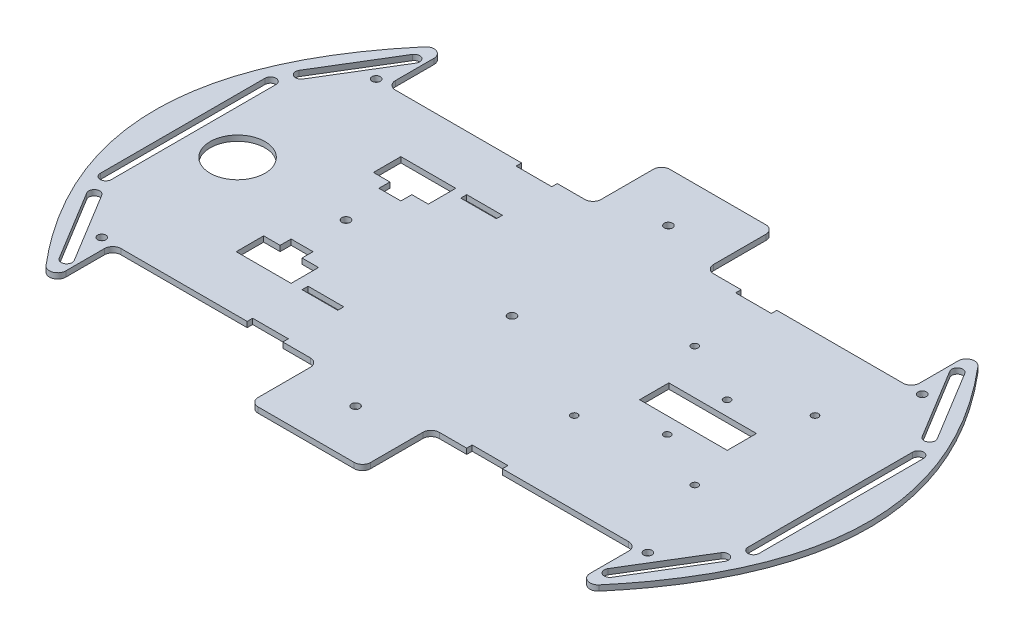
from build123d import *

# Parameters (mm, degrees)
SKETCH1_R           = 1.5
SKETCH1_W           = 13
SKETCH1_H           = 2.19615452
SKETCH1_R_2         = 1.25
SKETCH1_R_3         = 10
SKETCH1_W_2         = 31.947413913
SKETCH1_H_2         = 10.649137971
BOSS_EXTRUDE1_DEPTH = 2
FILLET1_R           = 3


with BuildPart() as part:
    # Sketch1 → Boss-Extrude1 (new body)
    with BuildSketch(Plane(origin=(0, 0, 0), x_dir=(1, 0, 0), z_dir=(0, 1, 0))):
        with BuildLine():
            Line((-95.5, 69), (-95.5, 75))
            add(Edge.make_bspline(
                [(-95.5, 75), (-129.99999983, 37.500000185), (-130, 3.7e-07)],
                knots=[0, 0, 0, 0.499999998, 0.499999998, 0.499999998], degree=2))
            add(Edge.make_bspline(
                [(-130, 3.7e-07), (-130.00000017, -37.499999815), (-95.5, -75)],
                knots=[0.499999998, 0.499999998, 0.499999998, 1, 1, 1], degree=2))
            Line((-95.5, -75), (-95.5, -50))
            Line((-95.5, -50), (-46.5, -50))
            Line((-46.5, -50), (-46.5, -48))
            Line((-46.5, -48), (-33.5, -48))
            Line((-33.5, -48), (-33.5, -50))
            Line((-33.5, -50), (-20.5, -50))
            Line((-20.5, -50), (-20.5, -75))
            Line((-20.5, -75), (20.5, -75))
            Line((20.5, -75), (20.5, -50))
            Line((20.5, -50), (33.5, -50))
            Line((33.5, -50), (33.5, -48))
            Line((33.5, -48), (46.5, -48))
            Line((46.5, -48), (46.5, -50))
            Line((46.5, -50), (95.5, -50))
            Line((95.5, -50), (95.5, -75))
            add(Edge.make_bspline(
                [(130, -5.22e-07), (129.99999976, -37.500000261), (95.5, -75)],
                knots=[0.500000003, 0.500000003, 0.500000003, 1, 1, 1], degree=2))
            add(Edge.make_bspline(
                [(95.5, 75), (130.00000024, 37.499999739), (130, -5.22e-07)],
                knots=[0, 0, 0, 0.500000003, 0.500000003, 0.500000003], degree=2))
            Line((95.5, 75), (95.5, 50))
            Line((95.5, 50), (46.5, 50))
            Line((46.5, 50), (46.5, 48))
            Line((46.5, 48), (33.5, 48))
            Line((33.5, 48), (33.5, 50))
            Line((33.5, 50), (20.5, 50))
            Line((20.5, 50), (20.5, 75))
            Line((20.5, 75), (0, 75))
            Line((0, 75), (-20.5, 75))
            Line((-20.5, 75), (-20.5, 50))
            Line((-20.5, 50), (-33.5, 50))
            Line((-33.5, 50), (-33.5, 48))
            Line((-33.5, 48), (-46.5, 48))
            Line((-46.5, 48), (-46.5, 50))
            Line((-46.5, 50), (-95.5, 50))
            Line((-95.5, 50), (-95.5, 69))
        make_face()
        with BuildLine():
            Line((-100.665133807, -64.355482792), (-116.252551949, -38.722839626))
            ThreePointArc((-116.252551949, -38.722839626), (-115.58287028, -35.974835539), (-112.834866193, -36.644517208))
            Line((-112.834866193, -36.644517208), (-97.247448051, -62.277160374))
            ThreePointArc((-97.247448051, -62.277160374), (-97.91712972, -65.025164461), (-100.665133807, -64.355482792))
        make_face(mode=Mode.SUBTRACT)
        with Locations(Location((-99.5, -50, 0), (0, 0, 270))):
            Circle(SKETCH1_R, mode=Mode.SUBTRACT)
        with Locations((-40, -28.90192274)):
            Rectangle(SKETCH1_W, SKETCH1_H, mode=Mode.SUBTRACT)
        Polygon((-56.5, -16), (-56.5, -20), (-50.5, -20), (-50.5, -30), (-70.5, -30), (-70.5, -20), (-64.5, -20), (-64.5, -16), align=None, mode=Mode.SUBTRACT)
        with Locations(Location((0, -57, 0), (0, 0, 270))):
            Circle(SKETCH1_R, mode=Mode.SUBTRACT)
        with Locations(Location((99.5, -50, 0), (0, 0, 270))):
            Circle(SKETCH1_R, mode=Mode.SUBTRACT)
        with BuildLine():
            ThreePointArc((112.834866193, -36.644517208), (115.58287028, -35.974835539), (116.252551949, -38.722839626))
            Line((116.252551949, -38.722839626), (100.665133807, -64.355482792))
            ThreePointArc((100.665133807, -64.355482792), (97.91712972, -65.025164461), (97.247448051, -62.277160374))
            Line((97.247448051, -62.277160374), (112.834866193, -36.644517208))
        make_face(mode=Mode.SUBTRACT)
        with Locations(Location((42.829271356, -20.101181184, 0), (0, 0, 270))):
            Circle(SKETCH1_R_2, mode=Mode.SUBTRACT)
        with Locations(Location((86.669891789, -20.101181184, 0), (0, 0, 270))):
            Circle(SKETCH1_R_2, mode=Mode.SUBTRACT)
        with Locations(Location((65.695752993, -9.150979051, 0), (0, 0, 270))):
            Circle(SKETCH1_R_2, mode=Mode.SUBTRACT)
        with BuildLine():
            ThreePointArc((-120, 30), (-119.414213562, 31.414213562), (-118, 32))
            ThreePointArc((-118, 32), (-116.585786438, 31.414213562), (-116, 30))
            Line((-116, 30), (-116, -30))
            ThreePointArc((-116, -30), (-118, -32), (-120, -30))
            Line((-120, -30), (-120, 30))
        make_face(mode=Mode.SUBTRACT)
        with Locations(Location((-100, 0, 0), (0, 0, 270))):
            Circle(SKETCH1_R_3, mode=Mode.SUBTRACT)
        with Locations(Location((-60.5, 0, 0), (0, 0, 270))):
            Circle(SKETCH1_R, mode=Mode.SUBTRACT)
        Polygon((-70.5, 30), (-50.5, 30), (-50.5, 20), (-56.5, 20), (-56.5, 16), (-64.5, 16), (-64.5, 20), (-70.5, 20), align=None, mode=Mode.SUBTRACT)
        with Locations((-40, 28.90192274)):
            Rectangle(SKETCH1_W, SKETCH1_H, mode=Mode.SUBTRACT)
        with BuildLine():
            ThreePointArc((-100.665133807, 64.355482792), (-99.429827378, 65.259453908), (-97.91712972, 65.025164461))
            ThreePointArc((-97.91712972, 65.025164461), (-97.013158604, 63.789858032), (-97.247448051, 62.277160374))
            Line((-97.247448051, 62.277160374), (-112.834866193, 36.644517208))
            ThreePointArc((-112.834866193, 36.644517208), (-114.070172622, 35.740546092), (-115.58287028, 35.974835539))
            ThreePointArc((-115.58287028, 35.974835539), (-116.486841396, 37.210141968), (-116.252551949, 38.722839626))
            Line((-116.252551949, 38.722839626), (-100.665133807, 64.355482792))
        make_face(mode=Mode.SUBTRACT)
        with Locations(Location((-99.5, 50, 0), (0, 0, 270))):
            Circle(SKETCH1_R, mode=Mode.SUBTRACT)
        with Locations(Location((0, 0, 0), (0, 0, 270))):
            Circle(SKETCH1_R, mode=Mode.SUBTRACT)
        with Locations(Location((42.829271356, 23.739439249, 0), (0, 0, 270))):
            Circle(SKETCH1_R_2, mode=Mode.SUBTRACT)
        with Locations((65.695752993, 2.089777697)):
            Rectangle(SKETCH1_W_2, SKETCH1_H_2, mode=Mode.SUBTRACT)
        with Locations(Location((65.695752993, 12.673180248, 0), (0, 0, 270))):
            Circle(SKETCH1_R_2, mode=Mode.SUBTRACT)
        with BuildLine():
            Line((116, -30), (116, 30))
            ThreePointArc((116, 30), (118, 32), (120, 30))
            Line((120, 30), (120, -30))
            ThreePointArc((120, -30), (118, -32), (116, -30))
        make_face(mode=Mode.SUBTRACT)
        with Locations(Location((86.669891789, 23.739439249, 0), (0, 0, 270))):
            Circle(SKETCH1_R_2, mode=Mode.SUBTRACT)
        with BuildLine():
            ThreePointArc((1.5, 57), (-1.060660172, 55.939339828), (0, 58.5))
            ThreePointArc((0, 58.5), (1.060660172, 58.060660172), (1.5, 57))
        make_face(mode=Mode.SUBTRACT)
        with Locations(Location((99.5, 50, 0), (0, 0, 270))):
            Circle(SKETCH1_R, mode=Mode.SUBTRACT)
        with BuildLine():
            Line((100.665133807, 64.355482792), (116.252551949, 38.722839626))
            ThreePointArc((116.252551949, 38.722839626), (115.58287028, 35.974835539), (112.834866193, 36.644517208))
            Line((112.834866193, 36.644517208), (97.247448051, 62.277160374))
            ThreePointArc((97.247448051, 62.277160374), (97.91712972, 65.025164461), (100.665133807, 64.355482792))
        make_face(mode=Mode.SUBTRACT)
    extrude(amount=BOSS_EXTRUDE1_DEPTH)

    # Fillet1
    fillet1_edges = [part.edges().sort_by_distance(p)[0] for p in [
        (-20.5, 1, -50),
        (-20.5, 1, -75),
        (95.5, 1, -75),
        (20.5, 1, -75),
        (20.5, 1, -50),
        (95.5, 1, -50),
        (95.5, 1, 75),
        (95.5, 1, 50),
        (20.5, 1, 50),
        (20.5, 1, 75),
        (-20.5, 1, 75),
        (-20.5, 1, 50),
        (-95.5, 1, 50),
        (-95.5, 1, -50),
        (-95.5, 1, -75),
        (-95.5, 1, 75),
    ]]
    fillet(fillet1_edges, radius=FILLET1_R)


solid = part.part
